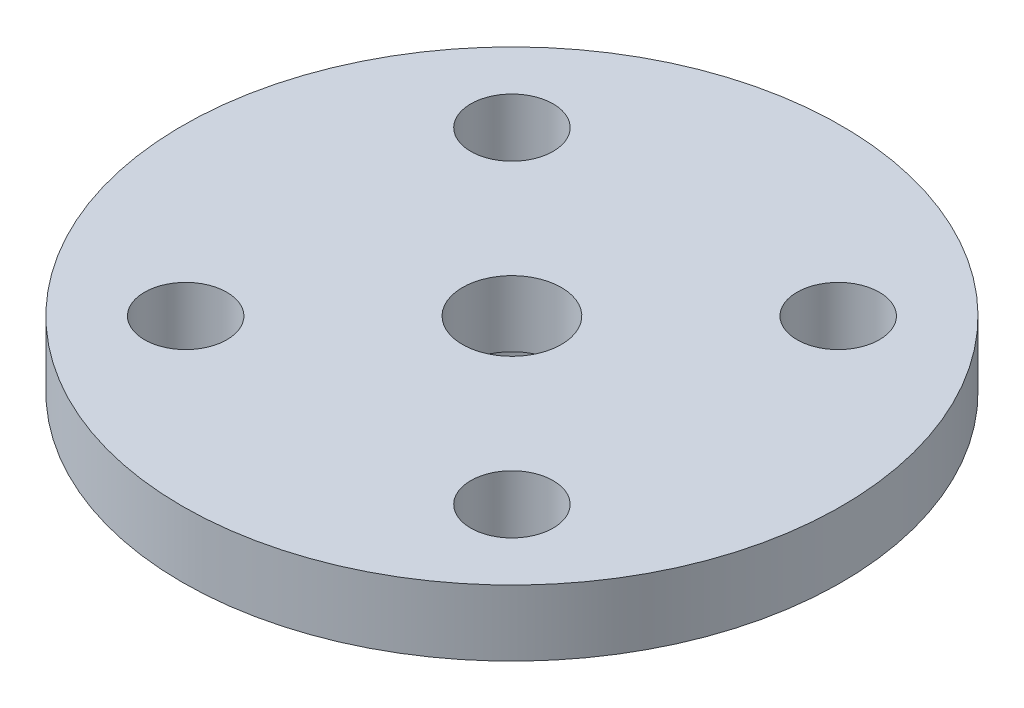
from build123d import *

# Parameters (mm, degrees)
TAP_DRILL_FOR_M3X0_5_TAP1_D           = 2.5
TAP_DRILL_FOR_M3X0_5_TAP1_CSINK_D     = 2.55
TAP_DRILL_FOR_M3X0_5_TAP1_CSINK_ANGLE = 90
SKETCH5_R                             = 2.75
CUT_EXTRUDE1_DEPTH                    = 3
SKETCH6_R                             = 1.5
CUT_EXTRUDE2_DEPTH                    = 15.456832295


with BuildPart() as part:
    # Sketch1 → Revolve1 (revolve)
    with BuildSketch(Plane(origin=(0, 0, 0), x_dir=(0, 0, -1), z_dir=(1, 0, 0))):
        Polygon((0, 0), (-10, 0), (-10, -2), (-4.5, -2), (-4.5, -5), (0, -5), align=None)
    revolve(axis=Axis((0, 0, 0), (0, -1, 0)))

    # Tap Drill for M3x0.5 Tap1 (through all)
    with Locations(Plane(origin=(0, -2, 0), x_dir=(-1, 0, 0), z_dir=(0, -1, 0))):
        with Locations((4.949747468, 4.949747468), (-4.949747468, -4.949747468), (-4.949747468, 4.949747468), (4.949747468, -4.949747468)):
            CounterSinkHole(TAP_DRILL_FOR_M3X0_5_TAP1_D / 2, TAP_DRILL_FOR_M3X0_5_TAP1_CSINK_D / 2, counter_sink_angle=TAP_DRILL_FOR_M3X0_5_TAP1_CSINK_ANGLE)

    # Sketch5 → Cut-Extrude1 (cut)
    with BuildSketch(Plane(origin=(0, -5, 0), x_dir=(-1, 0, 0), z_dir=(0, -1, 0))):
        with Locations(Location((0, 0, 0), (0, 0, 90))):
            Circle(SKETCH5_R)
    extrude(amount=-CUT_EXTRUDE1_DEPTH, mode=Mode.SUBTRACT)

    # Sketch6 → Cut-Extrude2 (cut, through all)
    with BuildSketch(Plane(origin=(0, -2, 0), x_dir=(-1, 0, 0), z_dir=(0, -1, 0))):
        with Locations(Location((0, 0, 0), (0, 0, 90))):
            Circle(SKETCH6_R)
    extrude(amount=-CUT_EXTRUDE2_DEPTH, mode=Mode.SUBTRACT)


solid = part.part
